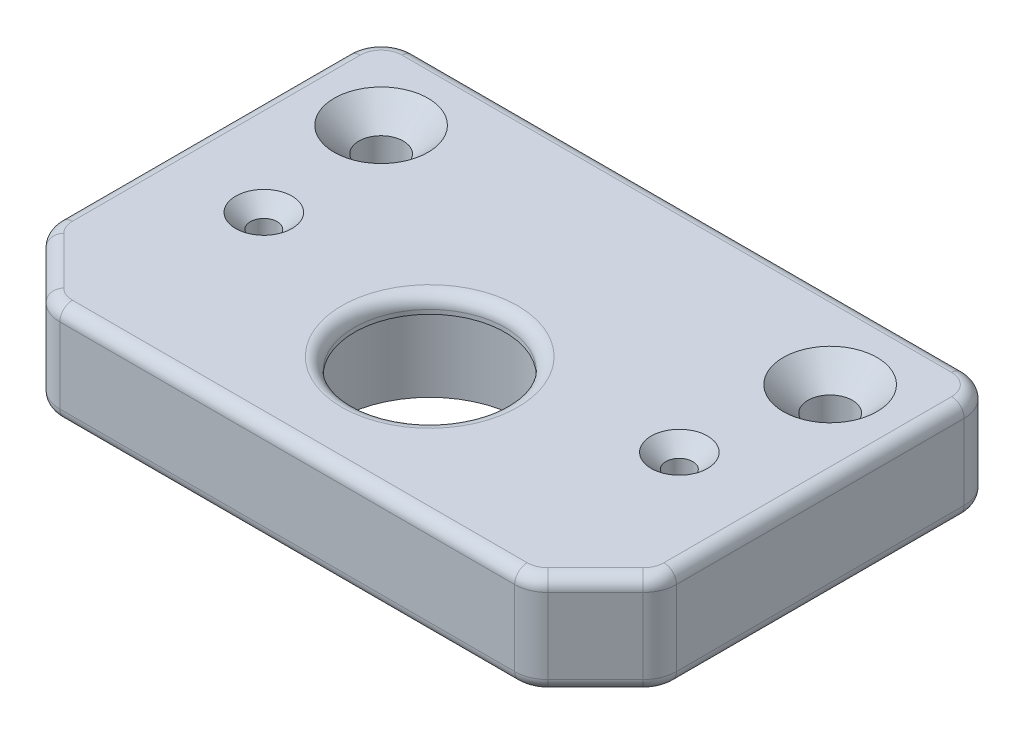
from build123d import *

# Parameters (mm, degrees)
SKETCH3_R                     = 11
BOSS_EXTRUDE1_DEPTH           = 10
SKETCH4_W                     = 73.6
SKETCH4_H                     = 48
SKETCH4_R                     = 9
BOSS_EXTRUDE2_DEPTH           = 2
CSK_FOR_M5_SFHCS1_D           = 5.3
CSK_FOR_M5_SFHCS1_CSINK_D     = 11.2
CSK_FOR_M5_SFHCS1_CSINK_ANGLE = 90
CHAMFER1_SIZE                 = 8
FILLET1_R                     = 4
FILLET2_R                     = 1.5
CSK_FOR_M3_SFHCS1_D           = 3.2
CSK_FOR_M3_SFHCS1_CSINK_D     = 6.72
CSK_FOR_M3_SFHCS1_CSINK_ANGLE = 90


with BuildPart() as part:
    # Sketch3 → Boss-Extrude1 (new body)
    with BuildSketch(Plane(origin=(0, 0, 0), x_dir=(1, 0, 0), z_dir=(0, 1, 0))):
        Polygon((-17, -17), (17, -17), (36.8, -17), (36.8, 11), (36.8, 31), (-36.8, 31), (-36.8, 11), (-36.8, -17), align=None)
        with Locations(Location((0, 0, 0), (0, 0, 270))):
            Circle(SKETCH3_R, mode=Mode.SUBTRACT)
    extrude(amount=BOSS_EXTRUDE1_DEPTH)

    # Sketch4 → Boss-Extrude2 (add)
    with BuildSketch(Plane(origin=(0, 10, 0), x_dir=(1, 0, 0), z_dir=(0, 1, 0))):
        with Locations((0, 7)):
            Rectangle(SKETCH4_W, SKETCH4_H)
        with Locations(Location((0, 0, 0), (0, 0, 270))):
            Circle(SKETCH4_R, mode=Mode.SUBTRACT)
    extrude(amount=BOSS_EXTRUDE2_DEPTH)

    # CSK for M5 SFHCS1 (through all)
    with Locations(Plane(origin=(0, 12, 0), x_dir=(1, 0, 0), z_dir=(0, 1, 0))):
        with Locations((26.8, 21), (-26.8, 21)):
            CounterSinkHole(CSK_FOR_M5_SFHCS1_D / 2, CSK_FOR_M5_SFHCS1_CSINK_D / 2, counter_sink_angle=CSK_FOR_M5_SFHCS1_CSINK_ANGLE)

    # Chamfer1
    chamfer1_edges = [part.edges().sort_by_distance(p)[0] for p in [
        (-36.8, 6, 17),
        (36.8, 6, 17),
    ]]
    chamfer(chamfer1_edges, length=CHAMFER1_SIZE)

    # Fillet1
    fillet1_edges = [part.edges().sort_by_distance(p)[0] for p in [
        (-36.8, 6, -31),
        (36.8, 6, -31),
        (28.8, 6, 17),
        (-28.8, 6, 17),
        (-36.8, 6, 9),
        (36.8, 6, 9),
    ]]
    fillet(fillet1_edges, radius=FILLET1_R)

    # Fillet2
    fillet2_edges = [part.edges().sort_by_distance(p)[0] for p in [
        (0, 12, -9),
        (-36.8, 0, -9.828427125),
        (-36.8, 12, -9.828427125),
        (0, 0, 17),
        (-32.8, 0, 13),
        (0, 0, -31),
        (36.8, 0, -9.828427125),
        (32.8, 0, 13),
        (-28.67387948, 0, 16.69551813),
        (-36.49551813, 0, 8.87387948),
        (28.67387948, 0, 16.69551813),
        (36.49551813, 0, 8.87387948),
        (35.628427125, 0, -29.828427125),
        (-35.628427125, 0, -29.828427125),
        (0, 12, -31),
        (-32.8, 12, 13),
        (0, 12, 17),
        (32.8, 12, 13),
        (36.8, 12, -9.828427125),
        (-28.67387948, 12, 16.69551813),
        (-36.49551813, 12, 8.87387948),
        (28.67387948, 12, 16.69551813),
        (36.49551813, 12, 8.87387948),
        (35.628427125, 12, -29.828427125),
        (-35.628427125, 12, -29.828427125),
    ]]
    fillet(fillet2_edges, radius=FILLET2_R)

    # CSK for M3 SFHCS1 (through all)
    with Locations(Plane(origin=(0, 12, 0), x_dir=(1, 0, 0), z_dir=(0, 1, 0))):
        with Locations((24.8, 5), (-24.8, 5)):
            CounterSinkHole(CSK_FOR_M3_SFHCS1_D / 2, CSK_FOR_M3_SFHCS1_CSINK_D / 2, counter_sink_angle=CSK_FOR_M3_SFHCS1_CSINK_ANGLE)


solid = part.part
